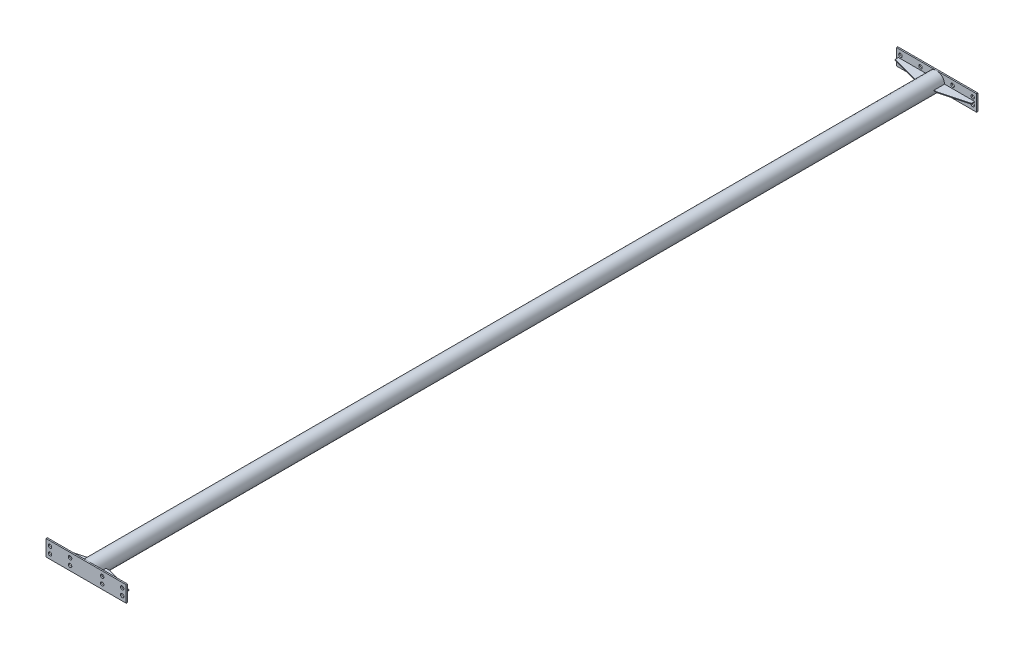
from build123d import *

# Parameters (mm, degrees)
SKETCH1_W               = 600
SKETCH1_H               = 120
BOSS_EXTRUDE1_DEPTH     = 10
SKETCH2_R               = 60
BOSS_EXTRUDE2_DEPTH     = 6350
BOSS_EXTRUDE3_DEPTH     = 2.5
BOSS_EXTRUDE3_2_DEPTH   = 2.5
CUT_EXTRUDE1_DEPTH      = 3200.660138202
CUT_EXTRUDE1_DEPTH_BACK = 3200.660138202
SKETCH6_R               = 13


with BuildPart() as part:
    # Sketch1 → Boss-Extrude1 (new body)
    with BuildSketch(Plane.XY):
        Rectangle(SKETCH1_W, SKETCH1_H)
    extrude(amount=BOSS_EXTRUDE1_DEPTH)


with BuildPart() as body_2:
    # Sketch2 → Boss-Extrude2 (new body)
    with BuildSketch(Plane.XY.offset(10)):
        with Locations(Location((0, 0, 0), (0, 0, 180))):
            Circle(SKETCH2_R)
    extrude(amount=BOSS_EXTRUDE2_DEPTH)


with BuildPart() as body_3:
    # Sketch4 → Boss-Extrude3 (new, symmetric)
    with BuildSketch(Plane(origin=(0, 0, 0), x_dir=(1, 0, 0), z_dir=(0, 1, 0))):
        Polygon((285, -10), (285, -35), (85, -88.589838486), (60, -88.589838486), (60, -10), align=None)
    extrude(amount=BOSS_EXTRUDE3_DEPTH, both=True)


with BuildPart() as body_4:
    # Sketch4 → Boss-Extrude3 2 (new, symmetric)
    with BuildSketch(Plane(origin=(0, 0, 0), x_dir=(1, 0, 0), z_dir=(0, 1, 0))):
        Polygon((-60, -10), (-285, -10), (-285, -35), (-85, -88.589838486), (-60, -88.589838486), align=None)
    extrude(amount=BOSS_EXTRUDE3_2_DEPTH, both=True)


with BuildPart() as body_5:
    # Mirror1: mirrored copy
    add(part.part.mirror(Plane(origin=(0, 0, 3185), x_dir=(1, 0, 0), z_dir=(0, 0, -1))))


with BuildPart() as body_6:
    # Mirror1 2: mirrored copy
    add(body_4.part.mirror(Plane(origin=(0, 0, 3185), x_dir=(1, 0, 0), z_dir=(0, 0, -1))))


with BuildPart() as body_7:
    # Mirror1 3: mirrored copy
    add(body_3.part.mirror(Plane(origin=(0, 0, 3185), x_dir=(1, 0, 0), z_dir=(0, 0, -1))))


with BuildPart() as cut_extrude1_tool:
    # Sketch6 → Cut-Extrude1 (new, two sides: drawn at the far end of the back side and taken through both)
    with BuildSketch(Plane(origin=(0, 0, 3185), x_dir=(-1, 0, 0), z_dir=(0, 0, -1)).offset(-CUT_EXTRUDE1_DEPTH_BACK)):
        with Locations((270, 25)):
            Circle(SKETCH6_R)
        with Locations((270, -25)):
            Circle(SKETCH6_R)
        with Locations((120, 25)):
            Circle(SKETCH6_R)
        with Locations((120, -25)):
            Circle(SKETCH6_R)
        with Locations(Location((-120, -25, 0), (0, 0, 180))):
            Circle(SKETCH6_R)
        with Locations(Location((-120, 25, 0), (0, 0, 180))):
            Circle(SKETCH6_R)
        with Locations(Location((-270, -25, 0), (0, 0, 180))):
            Circle(SKETCH6_R)
        with Locations(Location((-270, 25, 0), (0, 0, 180))):
            Circle(SKETCH6_R)
    extrude(amount=CUT_EXTRUDE1_DEPTH + CUT_EXTRUDE1_DEPTH_BACK)


with BuildPart() as part_1:
    add(part.part)

    # Cut-Extrude1: cut by cut_extrude1_tool
    add(cut_extrude1_tool.part, mode=Mode.SUBTRACT)


with BuildPart() as body_5_1:
    add(body_5.part)

    # Cut-Extrude1: cut by cut_extrude1_tool
    add(cut_extrude1_tool.part, mode=Mode.SUBTRACT)


solid = Compound([body_2.part, body_3.part, body_4.part, body_6.part, body_7.part, part_1.part, body_5_1.part])
